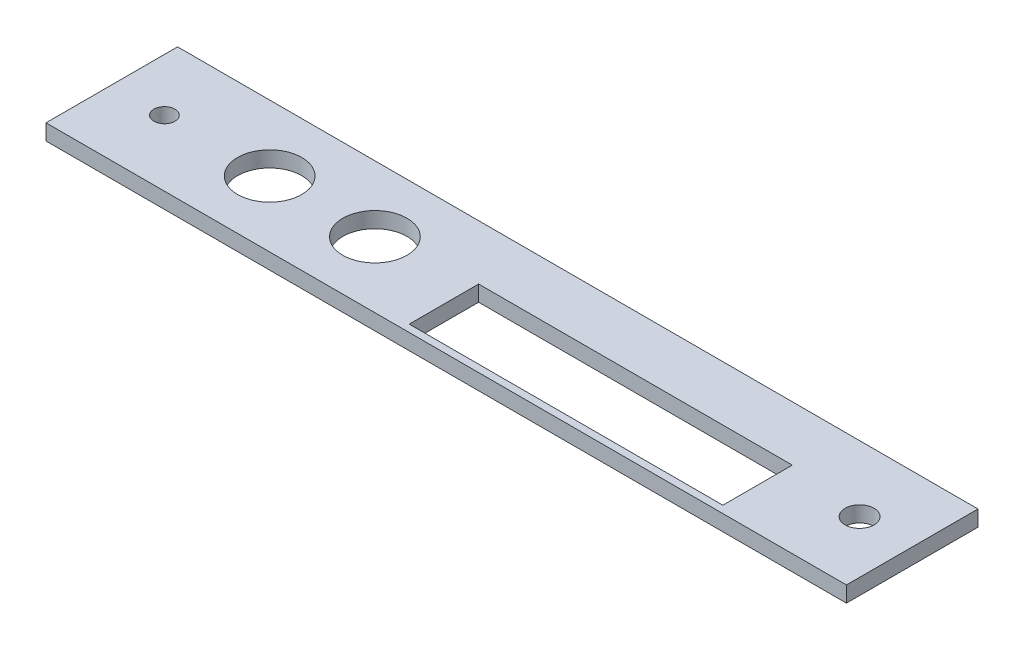
from build123d import *

# Parameters (mm, degrees)
ESQUISSE1_W             = 152.1
ESQUISSE1_H             = 25
ESQUISSE1_R             = 2.75
ESQUISSE1_R_2           = 2
BOSS_EXTRU_1_DEPTH      = 3
ESQUISSE3_R             = 6.1
ESQUISSE3_W             = 59.598609465
ESQUISSE3_H             = 13.189977142
ENL_V_MAT_EXTRU_2_DEPTH = 78.977892392


with BuildPart() as part:
    # Esquisse1 → Boss.-Extru.1 (new body)
    with BuildSketch(Plane(origin=(0, 0, 0), x_dir=(1, 0, 0), z_dir=(0, 1, 0))):
        with Locations((-0.495280426, -2.072980011)):
            Rectangle(ESQUISSE1_W, ESQUISSE1_H)
        with Locations(Location((65.554719574, -2.072980011, 0), (0, 0, 270))):
            Circle(ESQUISSE1_R, mode=Mode.SUBTRACT)
        with Locations(Location((-66.545280426, -2.072980011, 0), (0, 0, 270))):
            Circle(ESQUISSE1_R_2, mode=Mode.SUBTRACT)
    extrude(amount=BOSS_EXTRU_1_DEPTH)

    # Esquisse3 → Enlèv. mat.-Extru.2 (cut, through all)
    with BuildSketch(Plane(origin=(0, 0, 0), x_dir=(1, 0, 0), z_dir=(0, 1, 0))):
        with Locations(Location((-46.545280426, -2.072980011, 0), (0, 0, 270))):
            Circle(ESQUISSE3_R)
        with Locations(Location((-26.545280426, -2.072980011, 0), (0, 0, 270))):
            Circle(ESQUISSE3_R)
        with Locations((20.891233837, -6.594988571)):
            Rectangle(ESQUISSE3_W, ESQUISSE3_H)
    extrude(amount=ENL_V_MAT_EXTRU_2_DEPTH, mode=Mode.SUBTRACT)


solid = part.part
